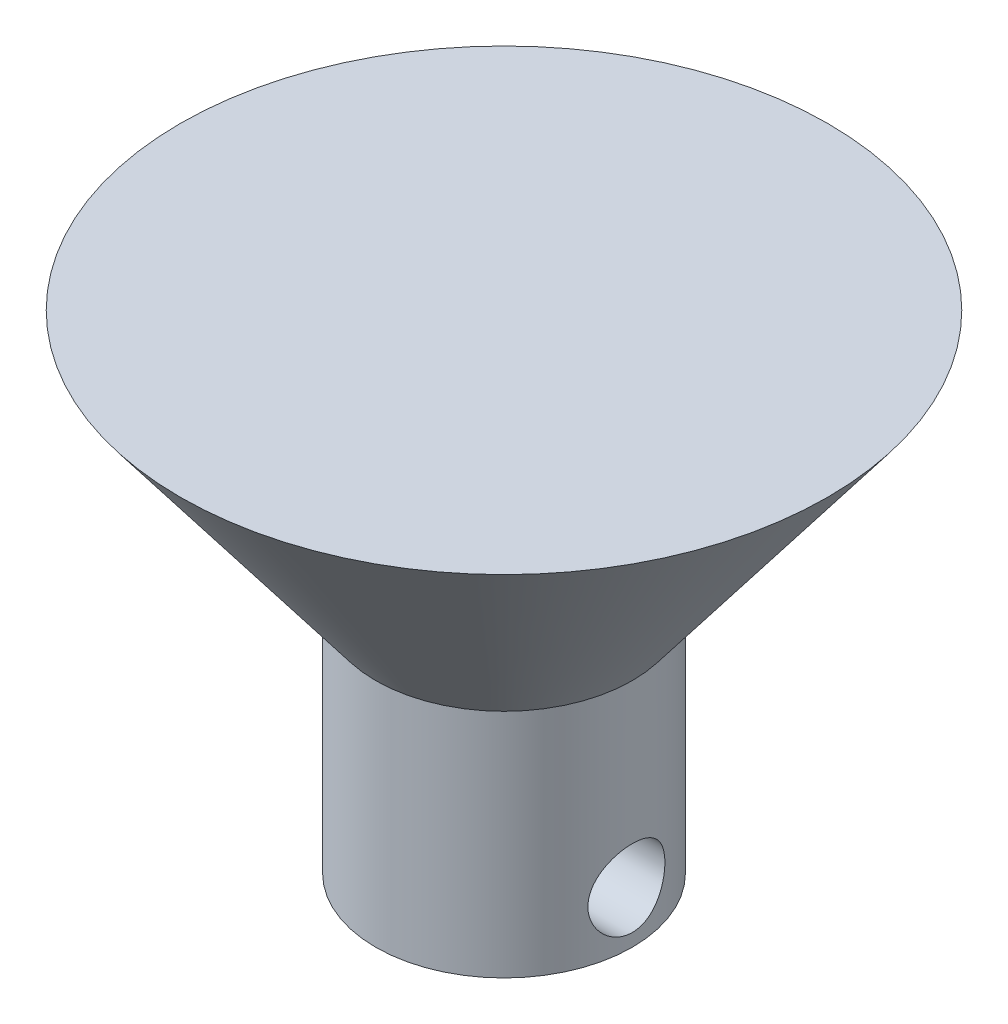
from build123d import *

# Parameters (mm, degrees)
SKETCH1_R             = 5
BODY_DEPTH            = 9
PIN_INSERT_DEPTH      = 12.445523142
PIN_INSERT_DEPTH_BACK = 12.445523142
SKETCH2_R             = 1.5
HEAD_SA_R             = 12.616


with BuildPart() as part:
    # Sketch1 → body (new body)
    with BuildSketch(Plane(origin=(0, 0, 0), x_dir=(1, 0, 0), z_dir=(0, 1, 0))):
        with Locations(Location((0, 0, 0), (0, 0, 270))):
            Circle(SKETCH1_R)
    extrude(amount=BODY_DEPTH)

    # Sketch2 → pin insert (cut, two sides: drawn at the far end of the back side and taken through both)
    with BuildSketch(Plane(origin=(0, 0, 0), x_dir=(0, 0, -1), z_dir=(1, 0, 0)).offset(-PIN_INSERT_DEPTH_BACK)):
        with Locations((0, 2)):
            Circle(SKETCH2_R)
    extrude(amount=PIN_INSERT_DEPTH + PIN_INSERT_DEPTH_BACK, mode=Mode.SUBTRACT)

    # head SA → section 0 of cone
    with BuildSketch(Plane(origin=(0, 19, 0), x_dir=(1, 0, 0), z_dir=(0, 1, 0)), mode=Mode.PRIVATE) as cone_s0:
        Circle(HEAD_SA_R)
    # loft up to a face of the part (cone)
    loft([cone_s0.sketch, part.faces().sort_by_distance((0, 9, 0))[0]])


solid = part.part
